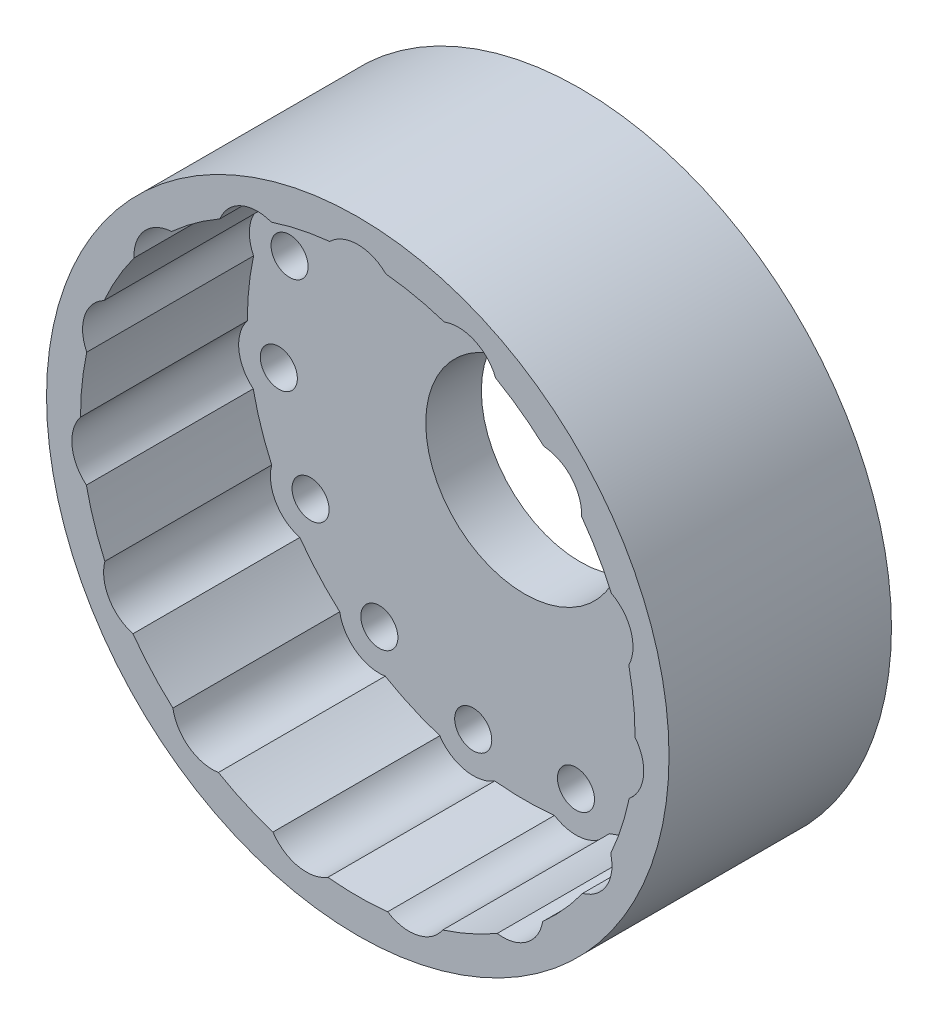
from build123d import *

# Parameters (mm, degrees)
SKETCH1_R           = 50.375
BOSS_EXTRUDE1_DEPTH = 9
SKETCH2_R           = 50.375
BOSS_EXTRUDE2_DEPTH = 27
SKETCH3_R           = 3
CUT_EXTRUDE3_DEPTH  = 5
SKETCH4_R           = 16
CUT_EXTRUDE4_DEPTH  = 77.185833657


with BuildPart() as part:
    # Sketch1 → Boss-Extrude1 (new body)
    with BuildSketch(Plane.XY):
        Circle(SKETCH1_R)
    extrude(amount=BOSS_EXTRUDE1_DEPTH)

    # Sketch2 → Boss-Extrude2 (add)
    with BuildSketch(Plane.XY.offset(9)):
        Circle(SKETCH2_R)
        with BuildLine():
            ThreePointArc((43.864306317, 9.470388393), (44.621611193, 4.762083526), (44.875, 0))
            ThreePointArc((44.875, 0), (44.874942611, -0.071767888), (44.874770445, -0.143535592))
            ThreePointArc((44.874770445, -0.143535592), (45.919292349, -2.043419548), (46.280875815, -4.181138531))
            ThreePointArc((46.280875815, -4.181138531), (45.662212981, -6.948786113), (43.923991772, -9.189590403))
            ThreePointArc((43.923991772, -9.189590403), (42.678661169, -13.867137623), (40.936761518, -18.383339778))
            ThreePointArc((40.936761518, -18.383339778), (41.089750325, -19.185243866), (41.141016151, -20))
            ThreePointArc((41.141016151, -20), (39.818405701, -23.929966596), (36.388820013, -26.260605535))
            ThreePointArc((36.388820013, -26.260605535), (33.348624043, -30.02723596), (29.920414626, -33.444497509))
            ThreePointArc((29.920414626, -33.444497509), (27.332014232, -37.619290238), (22.561690692, -38.790923399))
            ThreePointArc((22.561690692, -38.790923399), (18.252306858, -40.995352412), (13.730556226, -42.722797787))
            ThreePointArc((13.730556226, -42.722797787), (9.667893623, -45.483863434), (4.833440083, -44.613938203))
            ThreePointArc((4.833440083, -44.613938203), (0, -44.875), (-4.833440083, -44.613938203))
            ThreePointArc((-4.833440083, -44.613938203), (-9.667893623, -45.483863434), (-13.730556226, -42.722797787))
            ThreePointArc((-13.730556226, -42.722797787), (-18.252306858, -40.995352412), (-22.561690692, -38.790923399))
            ThreePointArc((-22.561690692, -38.790923399), (-27.332014232, -37.619290238), (-29.920414626, -33.444497509))
            ThreePointArc((-29.920414626, -33.444497509), (-33.348624043, -30.02723596), (-36.388820013, -26.260605535))
            ThreePointArc((-36.388820013, -26.260605535), (-40.270181276, -23.25), (-40.936761518, -18.383339778))
            ThreePointArc((-40.936761518, -18.383339778), (-42.678661169, -13.867137623), (-43.923991772, -9.189590403))
            ThreePointArc((-43.923991772, -9.189590403), (-46.245268135, -4.860573542), (-44.874770445, -0.143535592))
            ThreePointArc((-44.874770445, -0.143535592), (-44.629170055, 4.690714789), (-43.864306317, 9.470388393))
            ThreePointArc((-43.864306317, 9.470388393), (-44.224128008, 14.369290238), (-41.053523888, 18.121087202))
            ThreePointArc((-41.053523888, 18.121087202), (-38.862889995, 22.4375), (-36.220083805, 26.492851001))
            ThreePointArc((-36.220083805, 26.492851001), (-34.556234385, 31.114573196), (-30.133750091, 33.252409393))
            ThreePointArc((-30.133750091, 33.252409393), (-26.376863197, 36.304637623), (-22.313079754, 38.934458991))
            ThreePointArc((-22.313079754, 38.934458991), (-18.913253903, 42.47986378), (-14.003577146, 42.634087912))
            ThreePointArc((-14.003577146, 42.634087912), (-9.330037125, 43.894373583), (-4.547941505, 44.643945313))
            ThreePointArc((-4.547941505, 44.643945313), (0, 46.5), (4.547941505, 44.643945313))
            ThreePointArc((4.547941505, 44.643945313), (9.330037125, 43.894373583), (14.003577146, 42.634087912))
            ThreePointArc((14.003577146, 42.634087912), (18.913253903, 42.47986378), (22.313079754, 38.934458991))
            ThreePointArc((22.313079754, 38.934458991), (26.376863197, 36.304637623), (30.133750091, 33.252409393))
            ThreePointArc((30.133750091, 33.252409393), (34.464026918, 31.214846656), (36.225793019, 26.765224254))
            ThreePointArc((36.225793019, 26.765224254), (36.224365559, 26.629007713), (36.220083805, 26.492851001))
            ThreePointArc((36.220083805, 26.492851001), (38.862889995, 22.4375), (41.053523888, 18.121087202))
            ThreePointArc((41.053523888, 18.121087202), (43.602081289, 15.72793303), (44.542260652, 12.360679775))
            ThreePointArc((44.542260652, 12.360679775), (44.370502778, 10.876310688), (43.864306317, 9.470388393))
        make_face(mode=Mode.SUBTRACT)
    extrude(amount=BOSS_EXTRUDE2_DEPTH)

    # Sketch3 → Cut-Extrude3 (cut)
    with BuildSketch(Plane.XY.offset(9)):
        with Locations((0, 40)):
            Circle(SKETCH3_R)
        with Locations((16.269465723, 36.541818306)):
            Circle(SKETCH3_R)
        with Locations((29.725793019, 26.765224254)):
            Circle(SKETCH3_R)
        with Locations((38.042260652, 12.360679775)):
            Circle(SKETCH3_R)
        with Locations((39.780875815, -4.181138531)):
            Circle(SKETCH3_R)
        with Locations((34.641016151, -20)):
            Circle(SKETCH3_R)
        with Locations((23.511410092, -32.360679775)):
            Circle(SKETCH3_R)
        with Locations((8.316467633, -39.125904029)):
            Circle(SKETCH3_R)
        with Locations((-8.316467633, -39.125904029)):
            Circle(SKETCH3_R)
        with Locations((-23.511410092, -32.360679775)):
            Circle(SKETCH3_R)
        with Locations((-34.641016151, -20)):
            Circle(SKETCH3_R)
        with Locations((-39.780875815, -4.181138531)):
            Circle(SKETCH3_R)
        with Locations((-38.042260652, 12.360679775)):
            Circle(SKETCH3_R)
        with Locations((-29.725793019, 26.765224254)):
            Circle(SKETCH3_R)
        with Locations((-16.269465723, 36.541818306)):
            Circle(SKETCH3_R)
    extrude(amount=-CUT_EXTRUDE3_DEPTH, mode=Mode.SUBTRACT)

    # Sketch4 → Cut-Extrude4 (cut, through all)
    with BuildSketch(Plane.XY.offset(9)):
        Circle(SKETCH4_R)
    extrude(amount=-CUT_EXTRUDE4_DEPTH, mode=Mode.SUBTRACT)


solid = part.part
